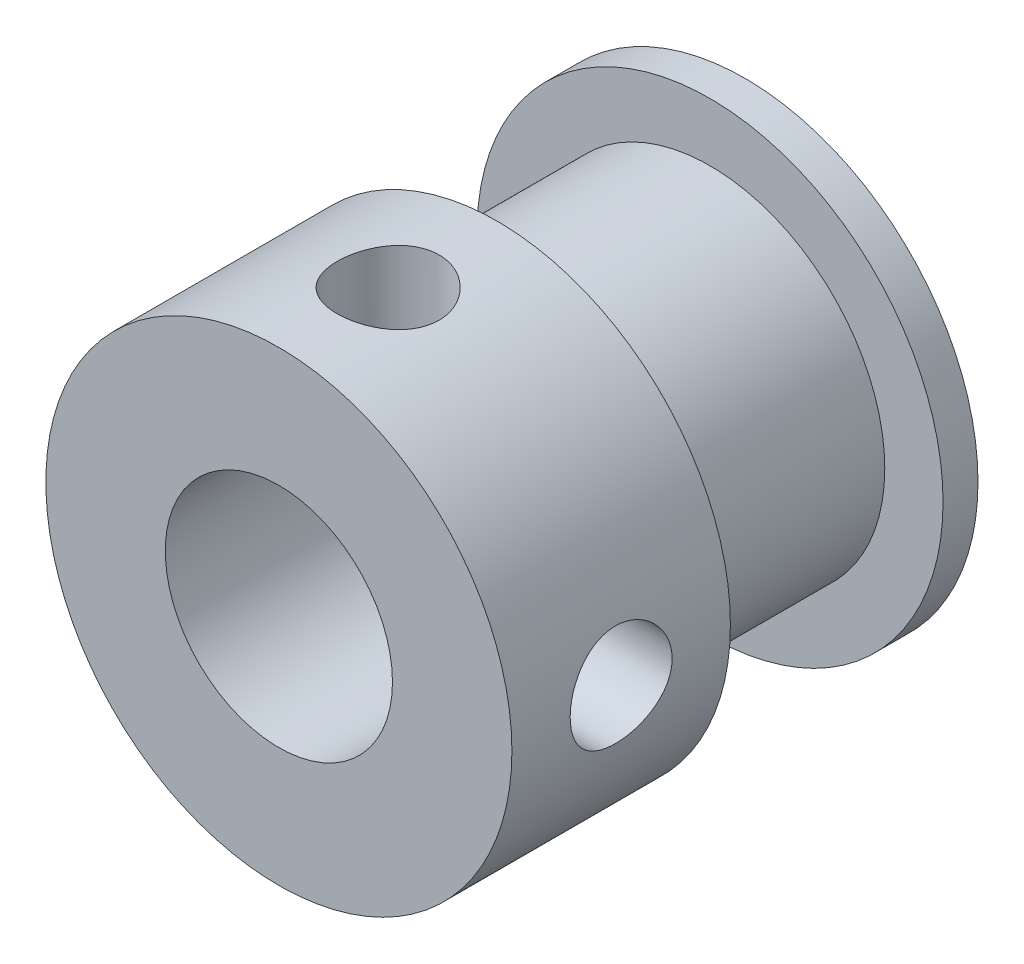
from build123d import *

# Parameters (mm, degrees)
SKETCH2_R               = 8
SKETCH2_R_2             = 3.9
BOSS_EXTRUDE1_DEPTH     = 16
SKETCH3_OUTSIDE_W       = 23.542
SKETCH3_OUTSIDE_H       = 23.542
SKETCH3_OUTSIDE_R       = 6
CUT_EXTRUDE1_DEPTH      = 7.3
CUT_EXTRUDE2_REACH      = 26
CUT_EXTRUDE2_END_RADIUS = 3.9
SKETCH6_R               = 1.75
CUT_EXTRUDE3_REACH      = 26
CUT_EXTRUDE3_END_RADIUS = 3.9
SKETCH5_R               = 1.75


with BuildPart() as part:
    # Sketch2 → Boss-Extrude1 (new body)
    with BuildSketch(Plane.XY):
        Circle(SKETCH2_R)
        Circle(SKETCH2_R_2, mode=Mode.SUBTRACT)
    extrude(amount=BOSS_EXTRUDE1_DEPTH)

    # Sketch3 outside → Cut-Extrude1 (cut)
    with BuildSketch(Plane.XY.offset(1.2)):
        Rectangle(SKETCH3_OUTSIDE_W, SKETCH3_OUTSIDE_H)
        with Locations(Location((0, 0, 0), (0, 0, 180))):
            Circle(SKETCH3_OUTSIDE_R, mode=Mode.SUBTRACT)
    extrude(amount=CUT_EXTRUDE1_DEPTH, mode=Mode.SUBTRACT)

    # Cut-Extrude2: up to this cylinder (the profile starts outside it)
    cut_extrude2_end = Plane(origin=(0, 0, 12.25), z_dir=(0, 0, -1)) * Cylinder(CUT_EXTRUDE2_END_RADIUS, 60.8, mode=Mode.PRIVATE)
    # Sketch6 → Cut-Extrude2 (cut, up to the surface)
    with BuildSketch(Plane(origin=(8, 0, 0), x_dir=(0, 0, -1), z_dir=(1, 0, 0)), mode=Mode.PRIVATE) as cut_extrude2_sk1:
        with Locations((-12.25, 0)):
            Circle(SKETCH6_R)
    cut_extrude2_tool1 = extrude(cut_extrude2_sk1.sketch, amount=-CUT_EXTRUDE2_REACH, mode=Mode.PRIVATE) - cut_extrude2_end
    add(cut_extrude2_tool1.solids().sort_by_distance((8, 0, 12.25))[0], mode=Mode.SUBTRACT)

    # Cut-Extrude3: up to this cylinder (the profile starts outside it)
    cut_extrude3_end = Plane(origin=(0, 0, 12.25), z_dir=(0, 0, -1)) * Cylinder(CUT_EXTRUDE3_END_RADIUS, 60.8, mode=Mode.PRIVATE)
    # Sketch5 → Cut-Extrude3 (cut, up to the surface)
    with BuildSketch(Plane(origin=(0, 8, 0), x_dir=(1, 0, 0), z_dir=(0, 1, 0)), mode=Mode.PRIVATE) as cut_extrude3_sk1:
        with Locations(Location((0, -12.25, 0), (0, 0, 270))):
            Circle(SKETCH5_R)
    cut_extrude3_tool1 = extrude(cut_extrude3_sk1.sketch, amount=-CUT_EXTRUDE3_REACH, mode=Mode.PRIVATE) - cut_extrude3_end
    add(cut_extrude3_tool1.solids().sort_by_distance((0, 8, 12.25))[0], mode=Mode.SUBTRACT)


solid = part.part
